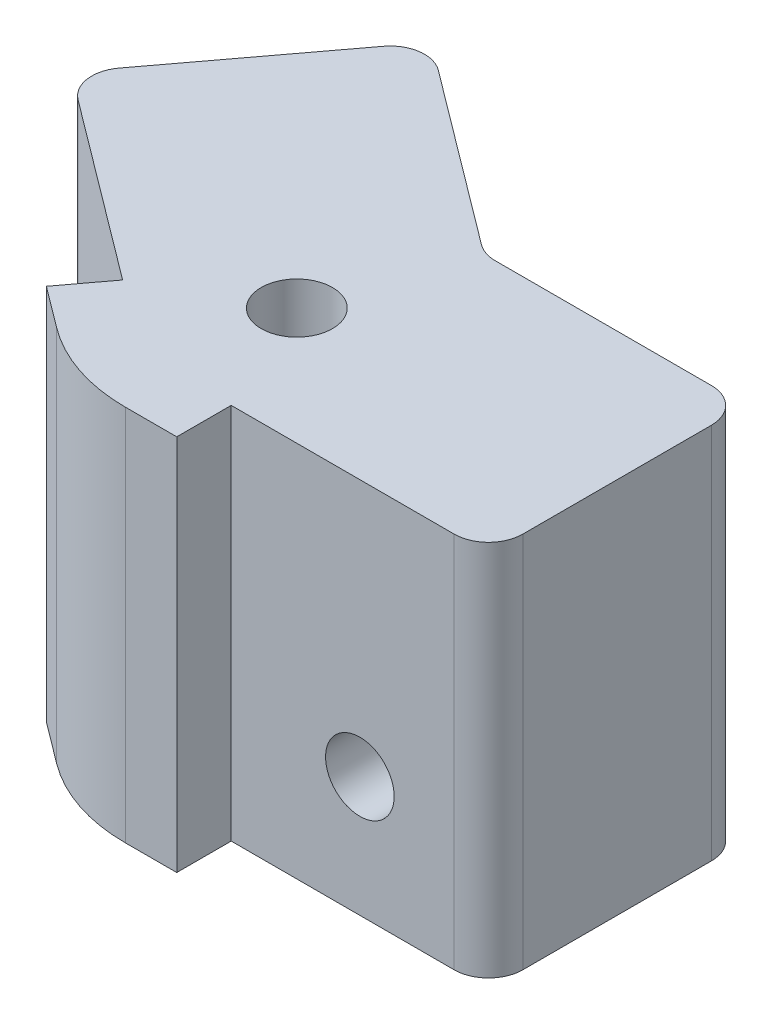
from build123d import *

# Parameters (mm, degrees)
SKETCH1_R           = 2.0788
BOSS_EXTRUDE1_DEPTH = 70
SKETCH2_R           = 2
CUT_EXTRUDE1_DEPTH  = 15
SKETCH3_R           = 2
CUT_EXTRUDE2_DEPTH  = 15
CUT_EXTRUDE3_DEPTH  = 5
CUT_EXTRUDE4_DEPTH  = 5
CUT_EXTRUDE5_START  = -5
CUT_EXTRUDE5_DEPTH  = 5
FILLET1_R           = 2
SKETCH8_W           = 42.920227698
SKETCH8_H           = 32.849947737
CUT_EXTRUDE6_DEPTH  = 48


with BuildPart() as part:
    # Sketch1 → Boss-Extrude1 (new body)
    with BuildSketch(Plane(origin=(0, 0, 0), x_dir=(1, 0, 0), z_dir=(0, 1, 0))):
        with BuildLine():
            Line((-18.495, 5.34), (-9.495, 17.34))
            Line((-9.495, 17.34), (2.725, 8.175))
            Line((2.725, 8.175), (18, 8.175))
            Line((18, 8.175), (18, -6.825))
            Line((18, -6.825), (3, -6.825))
            Line((3, -6.825), (3, -10))
            Line((3, -10), (0, -10))
            ThreePointArc((0, -10), (-3.16227766, -9.486832981), (-6, -8))
            Line((-6, -8), (-8.4, -6.2))
            Line((-8.4, -6.2), (-6.495, -3.66))
            Line((-6.495, -3.66), (-18.495, 5.34))
        make_face()
        with Locations(Location((0, 0, 0), (0, 0, 270))):
            Circle(SKETCH1_R, mode=Mode.SUBTRACT)
    extrude(amount=BOSS_EXTRUDE1_DEPTH)

    # Sketch2 → Cut-Extrude1 (cut)
    with BuildSketch(Plane.XY.offset(6.825)):
        with Locations((10.5, 15)):
            Circle(SKETCH2_R)
        with Locations((10.5, 55)):
            Circle(SKETCH2_R)
    extrude(amount=-CUT_EXTRUDE1_DEPTH, mode=Mode.SUBTRACT)

    # Sketch3 → Cut-Extrude2 (cut)
    with BuildSketch(Plane(origin=(-4.095, 0, 5.46), x_dir=(0.8000000000000002, 0, 0.5999999999999999), z_dir=(-0.5999999999999999, 0, 0.8000000000000003))):
        with Locations((-10.5, 15)):
            Circle(SKETCH3_R)
        with Locations((-10.5, 55)):
            Circle(SKETCH3_R)
    extrude(amount=-CUT_EXTRUDE2_DEPTH, mode=Mode.SUBTRACT)

    # Sketch4 → Cut-Extrude3 (cut)
    with BuildSketch(Plane(origin=(4.905, 0, -6.54), x_dir=(-0.8000000000000002, 0, -0.5999999999999998), z_dir=(0.5999999999999998, 0, -0.8000000000000002))):
        Polygon((10.5, 59.871392896), (6.28125, 57.435696448), (6.28125, 52.564303552), (10.5, 50.128607104), (14.71875, 52.564303552), (14.71875, 57.435696448), align=None)
        Polygon((10.5, 10.128607104), (14.71875, 12.564303552), (14.71875, 17.435696448), (10.5, 19.871392896), (6.28125, 17.435696448), (6.28125, 12.564303552), align=None)
    extrude(amount=-CUT_EXTRUDE3_DEPTH, mode=Mode.SUBTRACT)

    # Sketch5 → Cut-Extrude4 (cut)
    with BuildSketch(Plane(origin=(0, 0, -8.175), x_dir=(-1, 0, 0), z_dir=(0, 0, -1))):
        Polygon((-10.5, 50.128607104), (-6.28125, 52.564303552), (-6.28125, 57.435696448), (-10.5, 59.871392896), (-14.71875, 57.435696448), (-14.71875, 52.564303552), align=None)
        Polygon((-10.5, 10.128607104), (-6.28125, 12.564303552), (-6.28125, 17.435696448), (-10.5, 19.871392896), (-14.71875, 17.435696448), (-14.71875, 12.564303552), align=None)
    extrude(amount=-CUT_EXTRUDE4_DEPTH, mode=Mode.SUBTRACT)

    # Sketch7 → Cut-Extrude5 (cut)
    with BuildSketch(Plane(origin=(0, 70, 0), x_dir=(1, 0, 0), z_dir=(0, 1, 0)).offset(CUT_EXTRUDE5_START)):
        Polygon((-4.773906582, -0.97690802), (-0.83361646, 10.843962345), (2.725, 8.175), (7.173270575, 8.175), (3.232980454, -3.645870365), (-1.540926128, -4.622778385), align=None)
    extrude(amount=-CUT_EXTRUDE5_DEPTH, mode=Mode.SUBTRACT)

    # Fillet1
    fillet1_edges = [part.edges().sort_by_distance(p)[0] for p in [
        (2.725, 30, -8.175),
        (-18.495, 35, -5.34),
        (-9.495, 35, -17.34),
        (2.725, 67.5, -8.175),
        (18, 35, -8.175),
        (18, 35, 6.825),
    ]]
    fillet(fillet1_edges, radius=FILLET1_R)

    # Sketch8 → Cut-Extrude6 (cut)
    with BuildSketch(Plane.XZ):
        with Locations((0.986015294, -3.374502162)):
            Rectangle(SKETCH8_W, SKETCH8_H)
    extrude(amount=-CUT_EXTRUDE6_DEPTH, mode=Mode.SUBTRACT)


solid = part.part
